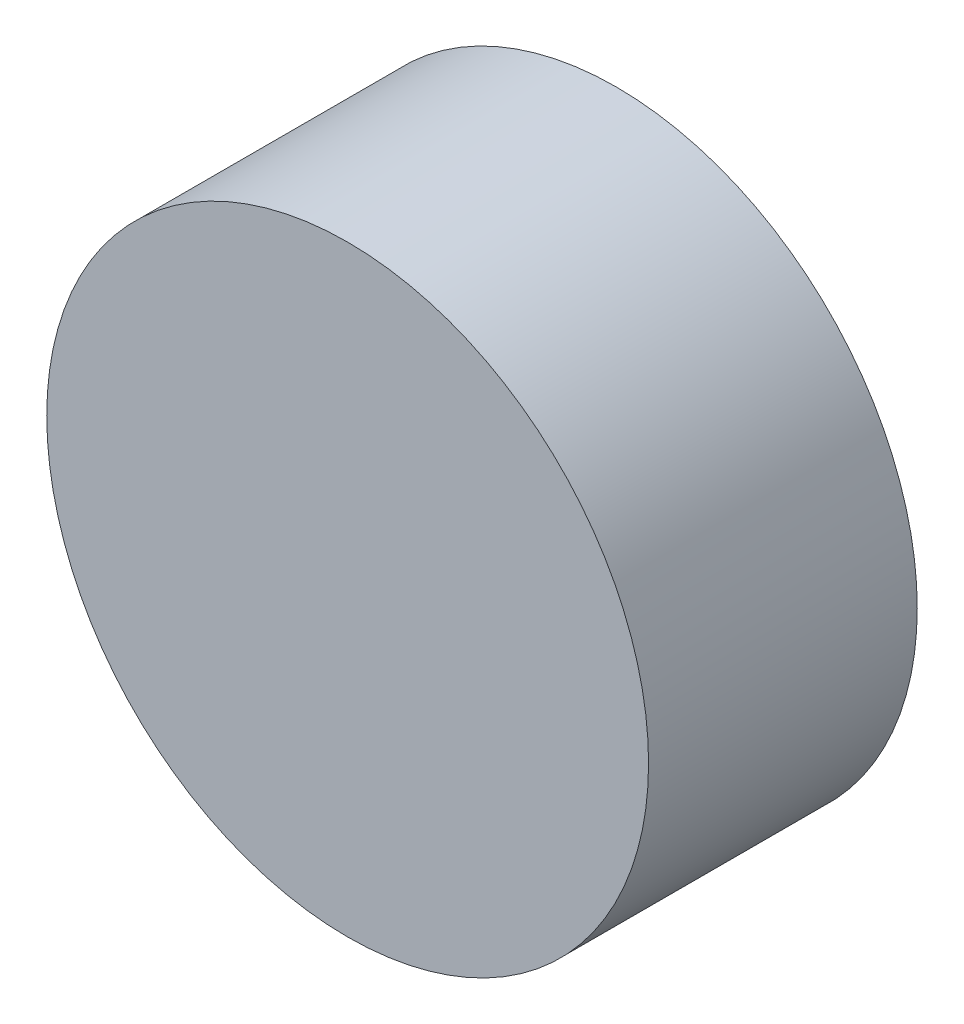
from build123d import *

# Parameters (mm, degrees)
SKETCH1_R           = 11.2
BOSS_EXTRUDE1_DEPTH = 10


with BuildPart() as part:
    # Sketch1 → Boss-Extrude1 (new body)
    with BuildSketch(Plane.XY):
        Circle(SKETCH1_R)
    extrude(amount=BOSS_EXTRUDE1_DEPTH)


solid = part.part
